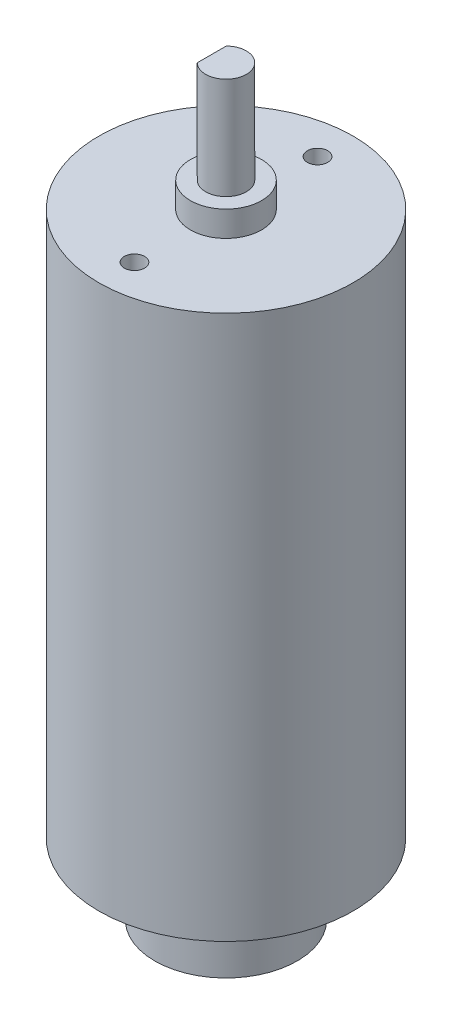
from build123d import *
from build123d.topology import SkipClean

# Parameters (mm, degrees)
SKETCH1_R        = 7
EXTRUSION1_DEPTH = 7
SKETCH2_R        = 12.5
EXTRUSION2_DEPTH = 53.5
SKETCH3_R        = 3.5
EXTRUSION3_DEPTH = 2.5
EXTRUSION4_DEPTH = 10
SKETCH5_R        = 2
EXTRUSION5_DEPTH = 2
HOLE1_D          = 2
HOLE1_DEPTH      = 10
HOLE1_TIP        = 0.600860619


with BuildPart() as part:
    # Sketch1 → Extrusion1 (new body)
    with BuildSketch(Plane(origin=(0, 0, 0), x_dir=(-1, 0, 0), z_dir=(0, 1, 0))):
        with Locations(Location((0, 0, 0), (0, 0, 90))):
            Circle(SKETCH1_R)
    extrude(amount=EXTRUSION1_DEPTH)

    # Sketch2 → Extrusion2 (add)
    with BuildSketch(Plane(origin=(0, 7, 0), x_dir=(-1, 0, 0), z_dir=(0, 1, 0))):
        with Locations(Location((0, 0, 0), (0, 0, 270))):
            Circle(SKETCH2_R)
    extrude(amount=EXTRUSION2_DEPTH)

    # Sketch3 → Extrusion3 (add)
    with BuildSketch(Plane(origin=(0, 60.5, 0), x_dir=(-1, 0, 0), z_dir=(0, 1, 0))):
        with Locations(Location((0, 0, 0), (0, 0, 90))):
            Circle(SKETCH3_R)
    extrude(amount=EXTRUSION3_DEPTH)

    # Sketch4 → Extrusion4 (add)
    with BuildSketch(Plane(origin=(0, 63, 0), x_dir=(-1, 0, 0), z_dir=(0, 1, 0))):
        with BuildLine():
            Line((1.4, 1.428285686), (1.4, -1.428285686))
            ThreePointArc((1.4, -1.428285686), (-2, 0), (1.4, 1.428285686))
        make_face()
    extrude(amount=EXTRUSION4_DEPTH)

    # Sketch5 → Extrusion5 (add)
    with SkipClean():  # the faces are left unmerged after this step: merging them gives an invalid solid
        with BuildSketch(Plane(origin=(0, 63, 0), x_dir=(1, 0, 0), z_dir=(0, 1, 0))):
            with Locations(Location((0, 0, 0), (0, 0, 134.427004001))):
                Circle(SKETCH5_R)
        extrude(amount=EXTRUSION5_DEPTH)

    # Hole1
    with Locations(Plane(origin=(0, 60.5, 0), x_dir=(1, 0, 0), z_dir=(0, 1, 0))):
        with Locations((0, -9), (0, 9)):
            Hole(HOLE1_D / 2, depth=HOLE1_DEPTH)
            with Locations((0, 0, -(HOLE1_DEPTH + HOLE1_TIP / 2))):  # 118° drill point
                Cone(0, HOLE1_D / 2, HOLE1_TIP, mode=Mode.SUBTRACT)


solid = part.part
